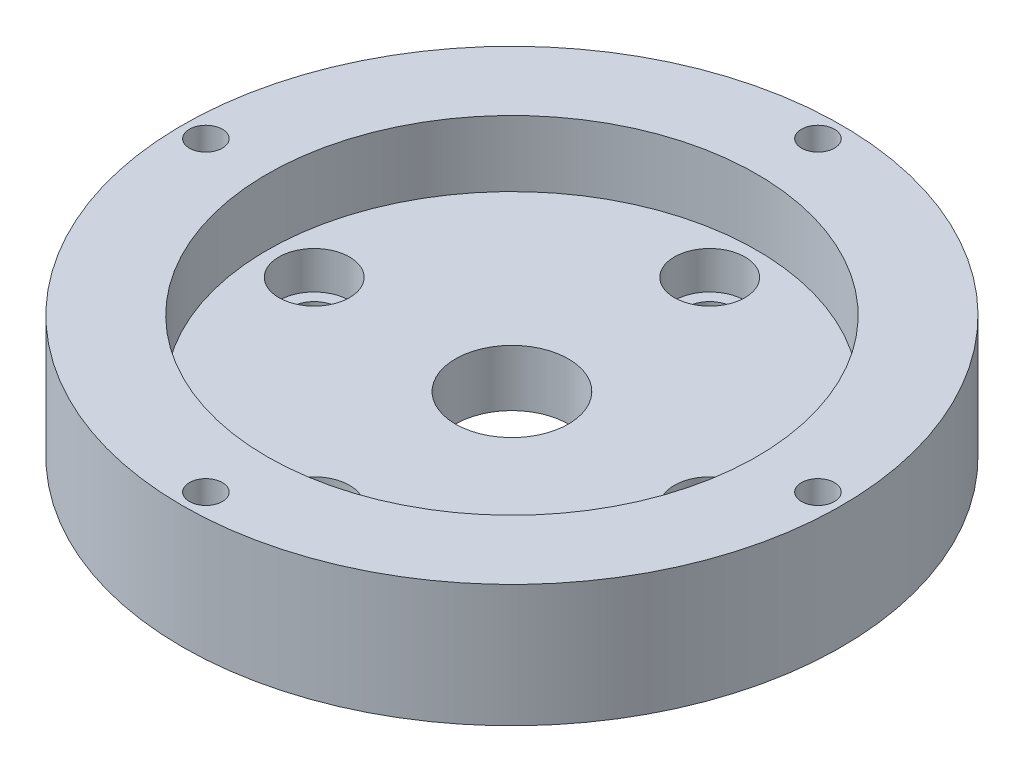
from build123d import *

# Parameters (mm, degrees)
SKETCH1_R           = 35
BOSS_EXTRUDE1_DEPTH = 6
SKETCH2_R           = 3.75
CUT_EXTRUDE1_DEPTH  = 4
SKETCH3_R           = 6
SKETCH3_R_2         = 2.5
CUT_EXTRUDE2_DEPTH  = 50.859803449
SKETCH4_R           = 35
SKETCH4_R_2         = 30
BOSS_EXTRUDE2_DEPTH = 7
SKETCH5_R           = 30
SKETCH5_R_2         = 26
BOSS_EXTRUDE3_DEPTH = 7
SKETCH6_R           = 1.75
CUT_EXTRUDE3_DEPTH  = 52.176166328
SKETCH7_R           = 2
CUT_EXTRUDE4_DEPTH  = 3


with BuildPart() as part:
    # Sketch1 → Boss-Extrude1 (new body)
    with BuildSketch(Plane(origin=(0, 0, 0), x_dir=(1, 0, 0), z_dir=(0, 1, 0))):
        with Locations(Location((0, 0, 0), (0, 0, 270))):
            Circle(SKETCH1_R)
    extrude(amount=BOSS_EXTRUDE1_DEPTH)

    # Sketch2 → Cut-Extrude1 (cut)
    with BuildSketch(Plane(origin=(0, 6, 0), x_dir=(1, 0, 0), z_dir=(0, 1, 0))):
        with Locations(Location((0, 21, 0), (0, 0, 270))):
            Circle(SKETCH2_R)
        with Locations(Location((21, 0, 0), (0, 0, 270))):
            Circle(SKETCH2_R)
        with Locations(Location((0, -21, 0), (0, 0, 270))):
            Circle(SKETCH2_R)
        with Locations(Location((-21, 0, 0), (0, 0, 270))):
            Circle(SKETCH2_R)
    extrude(amount=-CUT_EXTRUDE1_DEPTH, mode=Mode.SUBTRACT)

    # Sketch3 → Cut-Extrude2 (cut, through all)
    with BuildSketch(Plane(origin=(0, 6, 0), x_dir=(1, 0, 0), z_dir=(0, 1, 0))):
        with Locations(Location((0, 0, 0), (0, 0, 270))):
            Circle(SKETCH3_R)
        with Locations(Location((0, 21, 0), (0, 0, 270))):
            Circle(SKETCH3_R_2)
        with Locations(Location((21, 0, 0), (0, 0, 270))):
            Circle(SKETCH3_R_2)
        with Locations(Location((0, -21, 0), (0, 0, 270))):
            Circle(SKETCH3_R_2)
        with Locations(Location((-21, 0, 0), (0, 0, 270))):
            Circle(SKETCH3_R_2)
    extrude(amount=-CUT_EXTRUDE2_DEPTH, mode=Mode.SUBTRACT)

    # Sketch4 → Boss-Extrude2 (add)
    with BuildSketch(Plane(origin=(0, 6, 0), x_dir=(1, 0, 0), z_dir=(0, 1, 0))):
        with Locations(Location((0, 0, 0), (0, 0, 270))):
            Circle(SKETCH4_R)
        with Locations(Location((0, 0, 0), (0, 0, 270))):
            Circle(SKETCH4_R_2, mode=Mode.SUBTRACT)
    extrude(amount=BOSS_EXTRUDE2_DEPTH)

    # Sketch5 → Boss-Extrude3 (add)
    with BuildSketch(Plane(origin=(0, 6, 0), x_dir=(1, 0, 0), z_dir=(0, 1, 0))):
        Circle(SKETCH5_R)
        with Locations(Location((0, 0, 0), (0, 0, 270))):
            Circle(SKETCH5_R_2, mode=Mode.SUBTRACT)
    extrude(amount=BOSS_EXTRUDE3_DEPTH)

    # Sketch6 → Cut-Extrude3 (cut, through all)
    with BuildSketch(Plane(origin=(0, 13, 0), x_dir=(1, 0, 0), z_dir=(0, 1, 0))):
        with Locations(Location((0, 32.5, 0), (0, 0, 270))):
            Circle(SKETCH6_R)
        with Locations(Location((32.5, 0, 0), (0, 0, 270))):
            Circle(SKETCH6_R)
        with Locations(Location((0, -32.5, 0), (0, 0, 270))):
            Circle(SKETCH6_R)
        with Locations(Location((-32.5, 0, 0), (0, 0, 270))):
            Circle(SKETCH6_R)
    extrude(amount=-CUT_EXTRUDE3_DEPTH, mode=Mode.SUBTRACT)

    # Sketch7 → Cut-Extrude4 (cut)
    with BuildSketch(Plane.XZ):
        with Locations(Location((0, 32.5, 0), (0, 0, 270))):
            Circle(SKETCH7_R)
        with Locations(Location((32.5, 0, 0), (0, 0, 270))):
            Circle(SKETCH7_R)
        with Locations(Location((0, -32.5, 0), (0, 0, 270))):
            Circle(SKETCH7_R)
        with Locations(Location((-32.5, 0, 0), (0, 0, 270))):
            Circle(SKETCH7_R)
    extrude(amount=-CUT_EXTRUDE4_DEPTH, mode=Mode.SUBTRACT)


solid = part.part
